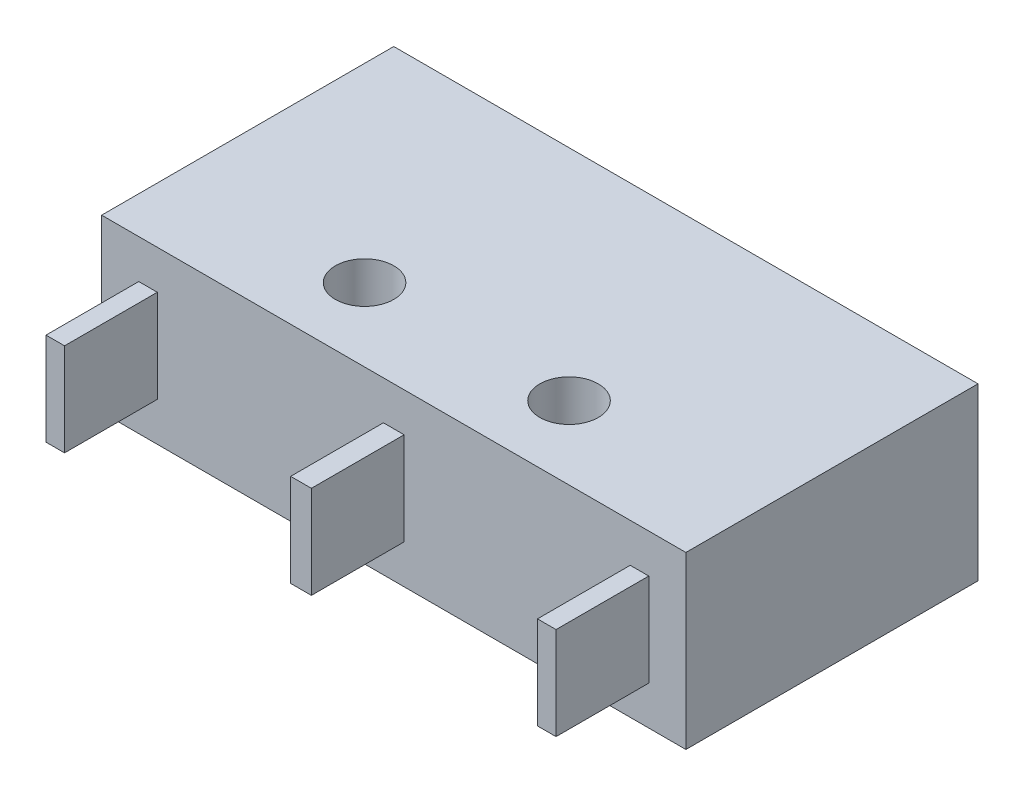
from build123d import *

# Parameters (mm, degrees)
ESQUISSE1_W             = 20
ESQUISSE1_H             = 10
BOSS_EXTRU_1_DEPTH      = 5.842
ESQUISSE2_W             = 0.635
ESQUISSE2_H             = 3.175
ESQUISSE2_W_2           = 0.70971707
BOSS_EXTRU_3_DEPTH      = 1.5875
ESQUISSE3_R             = 1
ENL_V_MAT_EXTRU_1_DEPTH = 15.176021621


with BuildPart() as part:
    # Esquisse1 → Boss.-Extru.1 (new body)
    with BuildSketch(Plane(origin=(0, 0, 0), x_dir=(1, 0, 0), z_dir=(0, 1, 0))):
        Rectangle(ESQUISSE1_W, ESQUISSE1_H)
    extrude(amount=BOSS_EXTRU_1_DEPTH)

    # Esquisse2 → Boss.-Extru.3 (add, symmetric)
    with BuildSketch(Plane(origin=(0, 2.921, 0), x_dir=(-1, 0, 0), z_dir=(0, -1, 0))):
        with Locations((8.4125, -6.5875)):
            Rectangle(ESQUISSE2_W, ESQUISSE2_H)
        with Locations((-8.4125, -6.5875)):
            Rectangle(ESQUISSE2_W, ESQUISSE2_H)
        with Locations((0, -6.5875)):
            Rectangle(ESQUISSE2_W_2, ESQUISSE2_H)
    extrude(amount=BOSS_EXTRU_3_DEPTH, both=True)

    # Esquisse3 → Enlèv. mat.-Extru.1 (cut, through all)
    with BuildSketch(Plane.XZ):
        with Locations(Location((3.5, 2.5, 0), (0, 0, 270))):
            Circle(ESQUISSE3_R)
        with Locations(Location((-3.5, 2.5, 0), (0, 0, 90))):
            Circle(ESQUISSE3_R)
    extrude(amount=-ENL_V_MAT_EXTRU_1_DEPTH, mode=Mode.SUBTRACT)


solid = part.part
